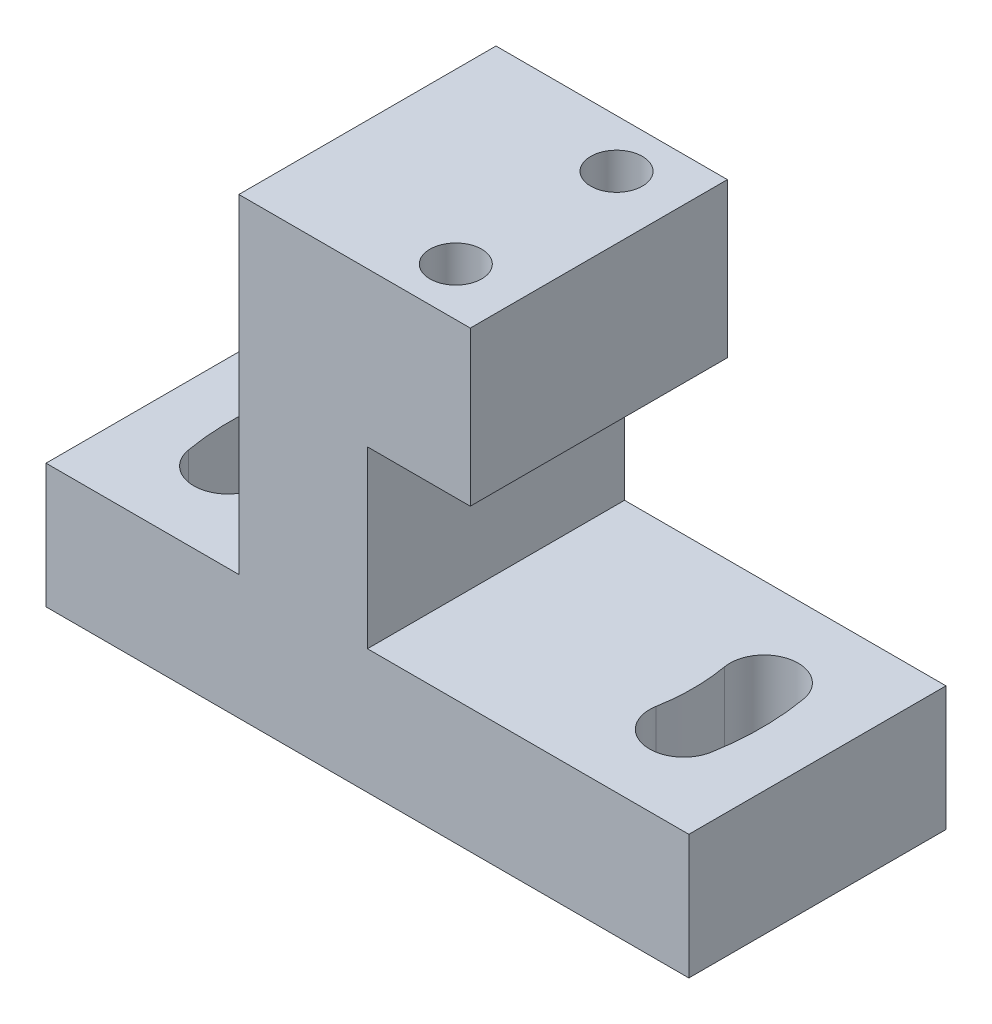
from build123d import *

# Parameters (mm, degrees)
EXTRUDE1_DEPTH             = 12.7
ARC_MOUNTING_SLOT_I_DEPTH  = 48.184559381
CLAMPING_SCREW_HOLES_D     = 5.1054
CLAMPING_SCREW_HOLES_DEPTH = 15.24
CLAMPING_SCREW_HOLES_TIP   = 1.533816902


with BuildPart() as part:
    # Sketch1 → Extrude1 (new, symmetric)
    with BuildSketch(Plane.XY):
        Polygon((-12.7, 44.8056), (10.16, 44.8056), (10.16, 29.5656), (0, 29.5656), (0, 12.2936), (12.7, 12.2936), (31.75, 12.2936), (31.75, 0), (-31.75, 0), (-31.75, 12.2936), (-12.7, 12.2936), align=None)
    extrude(amount=EXTRUDE1_DEPTH, both=True)

    # Sketch2 → Arc mounting slot I (cut, through all)
    with BuildSketch(Plane(origin=(0, 12.2936, 0), x_dir=(-1, 0, 0), z_dir=(0, 1, 0))):
        with BuildLine():
            ThreePointArc((-25.839582785, -4.556215615), (-21.92608696, -7.296474893), (-19.185827683, -3.382979068))
            ThreePointArc((-19.185827683, -3.382979068), (-19.4818, 0), (-19.185827683, 3.382979068))
            ThreePointArc((-19.185827683, 3.382979068), (-21.92608696, 7.296474893), (-25.839582785, 4.556215615))
            ThreePointArc((-25.839582785, 4.556215615), (-26.2382, 0), (-25.839582785, -4.556215615))
        make_face()
    arc_mounting_slot_i = extrude(amount=-ARC_MOUNTING_SLOT_I_DEPTH, mode=Mode.SUBTRACT)

    # Arc mounting slot II: Arc mounting slot I across plane
    add(arc_mounting_slot_i.mirror(Plane(origin=(0, 0, 0), x_dir=(0, 0, 1), z_dir=(1, 0, 0))), mode=Mode.SUBTRACT)

    # Clamping screw holes
    with Locations(Plane(origin=(0, 44.8056, 0), x_dir=(-1, 0, 0), z_dir=(0, 1, 0))):
        with Locations((-3.96875, -7.9375), (-3.96875, 7.9375)):
            Hole(CLAMPING_SCREW_HOLES_D / 2, depth=CLAMPING_SCREW_HOLES_DEPTH)
            with Locations((0, 0, -(CLAMPING_SCREW_HOLES_DEPTH + CLAMPING_SCREW_HOLES_TIP / 2))):  # 118° drill point
                Cone(0, CLAMPING_SCREW_HOLES_D / 2, CLAMPING_SCREW_HOLES_TIP, mode=Mode.SUBTRACT)


solid = part.part
